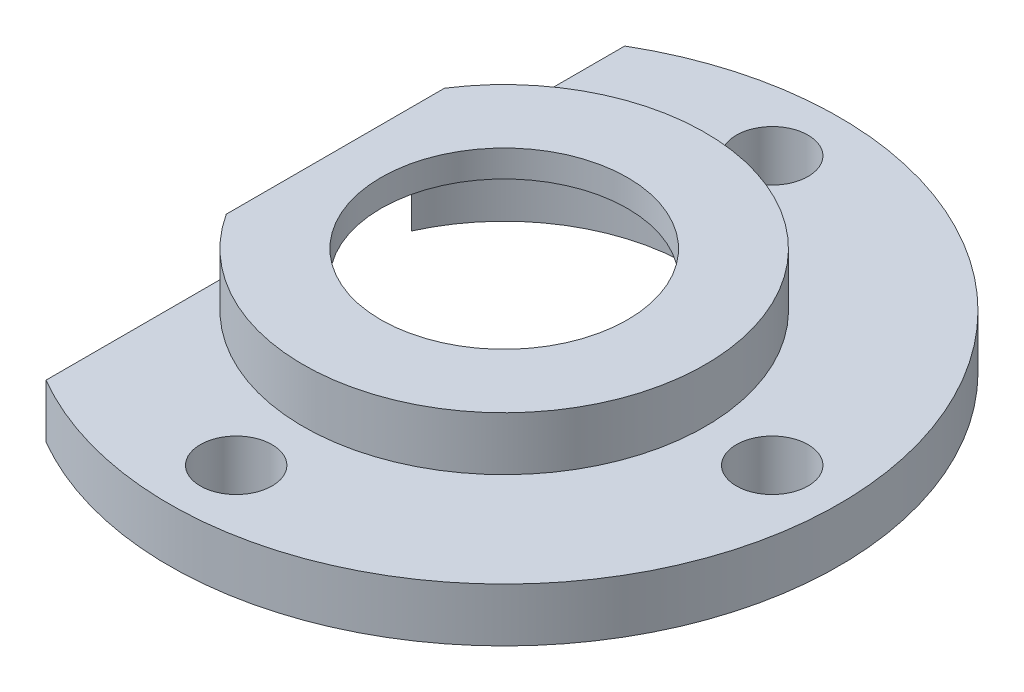
from build123d import *

# Parameters (mm, degrees)
SKETCH1_R                      = 15.875
BOSS_EXTRUDE1_DEPTH            = 2.54
SKETCH2_R                      = 9.525
BOSS_EXTRUDE2_DEPTH            = 2.54
SKETCH3_R                      = 8.7757
CUT_EXTRUDE1_DEPTH             = 3.81
CUT_EXTRUDE2_REACH             = 25.018
SKETCH4_R                      = 5.842
CUT_EXTRUDE3_REACH             = 24.594
SKETCH5_R                      = 1.7
CUT_EXTRUDE5_REACH             = 24.594
CUT_EXTRUDE5_DIRECTION_2_DEPTH = 2.794


with BuildPart() as part:
    # Sketch1 → Boss-Extrude1 (new body)
    with BuildSketch(Plane(origin=(0, 0, 0), x_dir=(1, 0, 0), z_dir=(0, 1, 0))):
        with Locations(Location((0, 0, 0), (0, 0, 270))):
            Circle(SKETCH1_R)
    extrude(amount=BOSS_EXTRUDE1_DEPTH)

    # Sketch2 → Boss-Extrude2 (add)
    with BuildSketch(Plane(origin=(0, 2.54, 0), x_dir=(1, 0, 0), z_dir=(0, 1, 0))):
        with Locations(Location((0, 0, 0), (0, 0, 270))):
            Circle(SKETCH2_R)
    extrude(amount=BOSS_EXTRUDE2_DEPTH)

    # Sketch3 → Cut-Extrude1 (cut)
    with BuildSketch(Plane.XZ):
        with Locations(Location((0, 0, 0), (0, 0, 270))):
            Circle(SKETCH3_R)
    extrude(amount=-CUT_EXTRUDE1_DEPTH, mode=Mode.SUBTRACT)

    # Sketch4 → Cut-Extrude2 (cut, up to next)
    with BuildSketch(Plane(origin=(0, 5.08, 0), x_dir=(1, 0, 0), z_dir=(0, 1, 0)), mode=Mode.PRIVATE) as cut_extrude2_sk1:
        with Locations(Location((0, 0, 0), (0, 0, 270))):
            Circle(SKETCH4_R)
    cut_extrude2_tool1 = extrude(cut_extrude2_sk1.sketch, amount=-CUT_EXTRUDE2_REACH, mode=Mode.PRIVATE) & part.part
    add(cut_extrude2_tool1.solids().sort_by_distance((0, 5.08, 0))[0], mode=Mode.SUBTRACT)

    # Sketch5 → Cut-Extrude3 (cut, up to next)
    with BuildSketch(Plane(origin=(0, 2.54, 0), x_dir=(1, 0, 0), z_dir=(0, 1, 0)), mode=Mode.PRIVATE) as cut_extrude3_sk1:
        with Locations(Location((0, 12.7, 0), (0, 0, 270))):
            Circle(SKETCH5_R)
    cut_extrude3_tool1 = extrude(cut_extrude3_sk1.sketch, amount=-CUT_EXTRUDE3_REACH, mode=Mode.PRIVATE) & part.part
    # Sketch5 → Cut-Extrude3 (cut, up to next)
    with BuildSketch(Plane(origin=(0, 2.54, 0), x_dir=(1, 0, 0), z_dir=(0, 1, 0)), mode=Mode.PRIVATE) as cut_extrude3_sk2:
        with Locations(Location((12.7, 0, 0), (0, 0, 270))):
            Circle(SKETCH5_R)
    cut_extrude3_tool2 = extrude(cut_extrude3_sk2.sketch, amount=-CUT_EXTRUDE3_REACH, mode=Mode.PRIVATE) & part.part
    # Sketch5 → Cut-Extrude3 (cut, up to next)
    with BuildSketch(Plane(origin=(0, 2.54, 0), x_dir=(1, 0, 0), z_dir=(0, 1, 0)), mode=Mode.PRIVATE) as cut_extrude3_sk3:
        with Locations(Location((0, -12.7, 0), (0, 0, 270))):
            Circle(SKETCH5_R)
    cut_extrude3_tool3 = extrude(cut_extrude3_sk3.sketch, amount=-CUT_EXTRUDE3_REACH, mode=Mode.PRIVATE) & part.part
    # Sketch5 → Cut-Extrude3 (cut, up to next)
    with BuildSketch(Plane(origin=(0, 2.54, 0), x_dir=(1, 0, 0), z_dir=(0, 1, 0)), mode=Mode.PRIVATE) as cut_extrude3_sk4:
        with Locations(Location((-12.7, 0, 0), (0, 0, 270))):
            Circle(SKETCH5_R)
    cut_extrude3_tool4 = extrude(cut_extrude3_sk4.sketch, amount=-CUT_EXTRUDE3_REACH, mode=Mode.PRIVATE) & part.part
    add(cut_extrude3_tool1.solids().sort_by_distance((0, 2.54, -12.7))[0], mode=Mode.SUBTRACT)
    add(cut_extrude3_tool2.solids().sort_by_distance((12.7, 2.54, 0))[0], mode=Mode.SUBTRACT)
    add(cut_extrude3_tool3.solids().sort_by_distance((0, 2.54, 12.7))[0], mode=Mode.SUBTRACT)
    add(cut_extrude3_tool4.solids().sort_by_distance((-12.7, 2.54, 0))[0], mode=Mode.SUBTRACT)

    # Sketch6 → Cut-Extrude5 (cut, up to next)
    with BuildSketch(Plane(origin=(0, 2.54, 0), x_dir=(1, 0, 0), z_dir=(0, 1, 0)), mode=Mode.PRIVATE) as cut_extrude5_sk1:
        with BuildLine():
            Line((-8, -13.711878974), (-8, 13.711878974))
            ThreePointArc((-8, 13.711878974), (-15.875, 0), (-8, -13.711878974))
        make_face()
    cut_extrude5_tool1 = extrude(cut_extrude5_sk1.sketch, amount=-CUT_EXTRUDE5_REACH, mode=Mode.PRIVATE) & part.part
    add(cut_extrude5_tool1.solids().sort_by_distance((-11.228338, 2.54, 0))[0], mode=Mode.SUBTRACT)

    # Sketch6 → Cut-Extrude5 direction 2 (cut)
    with BuildSketch(Plane(origin=(0, 2.54, 0), x_dir=(1, 0, 0), z_dir=(0, 1, 0))):
        with BuildLine():
            Line((-8, -13.711878974), (-8, 13.711878974))
            ThreePointArc((-8, 13.711878974), (-15.875, 0), (-8, -13.711878974))
        make_face()
    extrude(amount=CUT_EXTRUDE5_DIRECTION_2_DEPTH, mode=Mode.SUBTRACT)


solid = part.part
